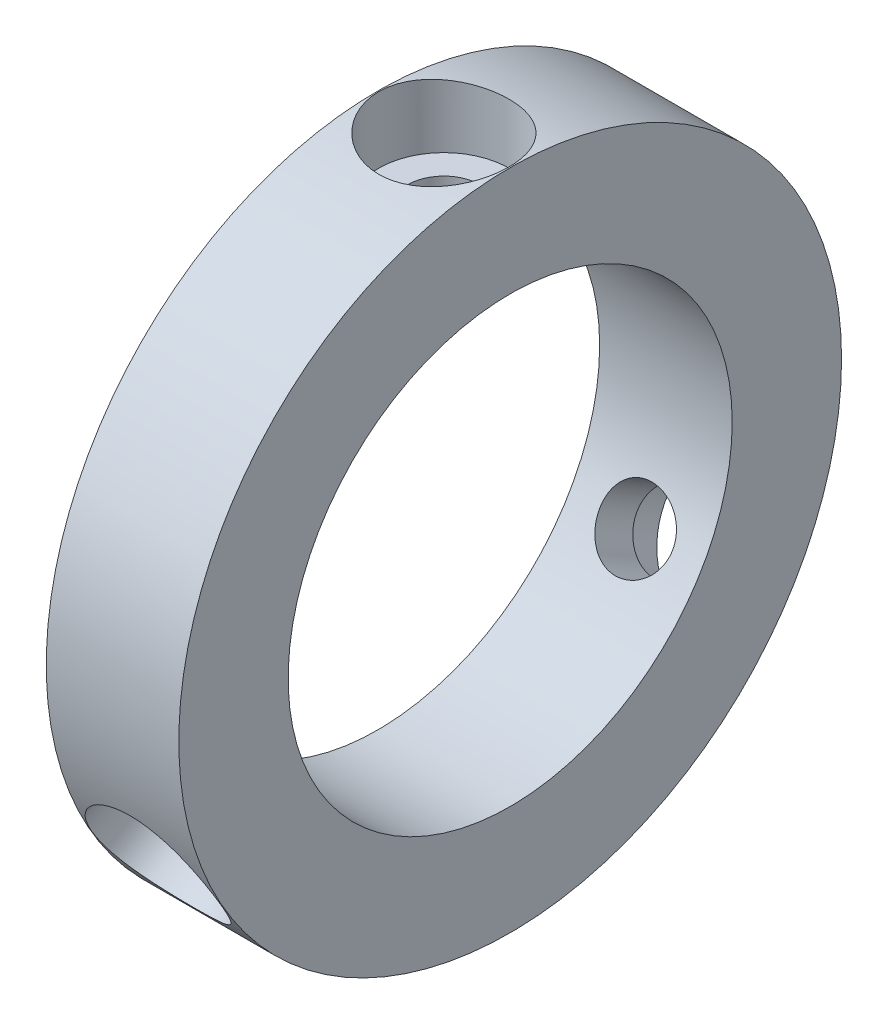
from build123d import *

# Parameters (mm, degrees)
SKETCH1_R           = 15
SKETCH1_R_2         = 10.05
BOSS_EXTRUDE1_DEPTH = 6
SKETCH3_R           = 2.95
CUT_EXTRUDE1_DEPTH  = 3
CIRPATTERN1_COUNT   = 3
SKETCH4_R           = 1.65
CUT_EXTRUDE2_DEPTH  = 11
CIRPATTERN3_COUNT   = 3


with BuildPart() as part:
    # Sketch1 → Boss-Extrude1 (new body)
    with BuildSketch(Plane(origin=(0, 0, 0), x_dir=(0, 0, -1), z_dir=(1, 0, 0))):
        Circle(SKETCH1_R)
        Circle(SKETCH1_R_2, mode=Mode.SUBTRACT)
    extrude(amount=BOSS_EXTRUDE1_DEPTH)

    # Sketch3 → Cut-Extrude1 (cut)
    with BuildSketch(Plane(origin=(0, -7.5, 12.990381057), x_dir=(1, 0, 0), z_dir=(0, -0.5000000000000044, 0.866025403784436))):
        with Locations(Location((3, 0, 0), (0, 0, 270))):
            Circle(SKETCH3_R)
    cut_extrude1 = extrude(amount=-CUT_EXTRUDE1_DEPTH, mode=Mode.SUBTRACT)

    # CirPattern1: Cut-Extrude1 ×3 about axis
    cirpattern1_axis = Axis((0, 0, 0), (1, 0, 0))
    for i in range(1, CIRPATTERN1_COUNT):
        add(cut_extrude1.rotate(cirpattern1_axis, i * 360 / CIRPATTERN1_COUNT), mode=Mode.SUBTRACT)

    # Sketch4 → Cut-Extrude2 (cut)
    with BuildSketch(Plane(origin=(0, -7.5, 12.990381057), x_dir=(1, 0, 0), z_dir=(0, -0.5000000000000044, 0.866025403784436))):
        with Locations(Location((3, 0, 0), (0, 0, 270))):
            Circle(SKETCH4_R)
    cut_extrude2 = extrude(amount=-CUT_EXTRUDE2_DEPTH, mode=Mode.SUBTRACT)

    # CirPattern3: Cut-Extrude2 ×3 about axis
    cirpattern3_axis = Axis((6, 0, 0), (-1, 0, 0))
    for i in range(1, CIRPATTERN3_COUNT):
        add(cut_extrude2.rotate(cirpattern3_axis, i * 360 / CIRPATTERN3_COUNT), mode=Mode.SUBTRACT)


solid = part.part
